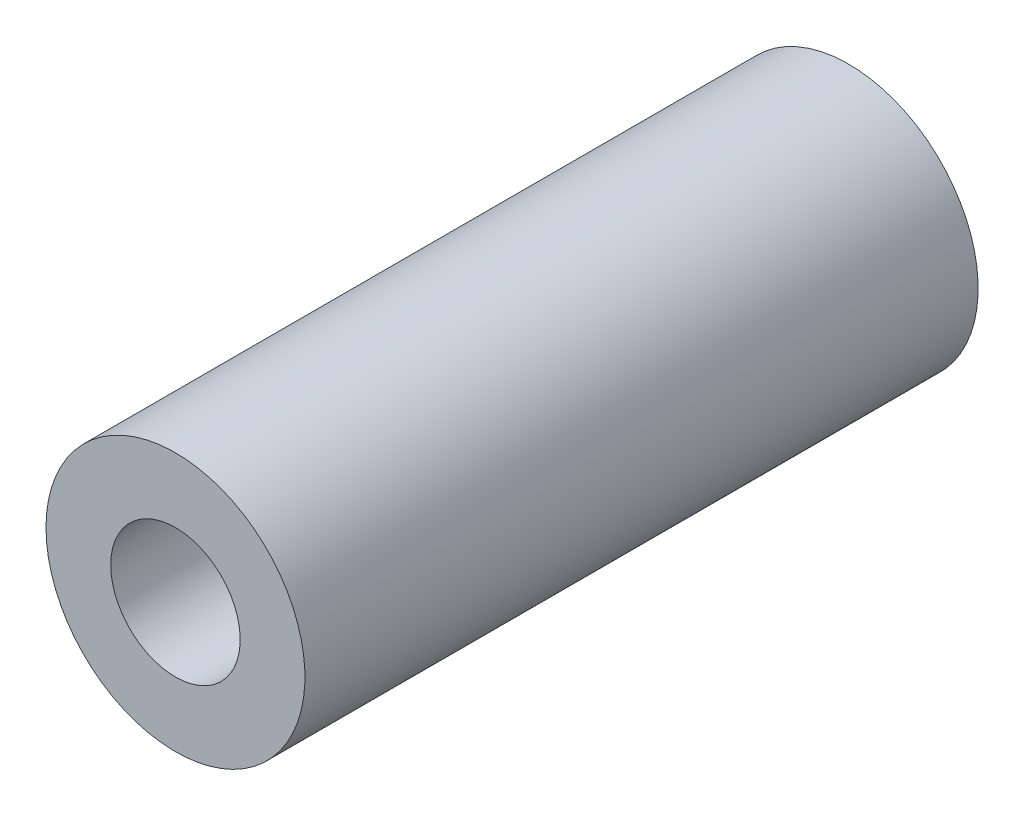
from build123d import *

# Parameters (mm, degrees)
SKETCH1_R           = 5
SKETCH1_R_2         = 2.5
BOSS_EXTRUDE1_DEPTH = 26


with BuildPart() as part:
    # Sketch1 → Boss-Extrude1 (new body)
    with BuildSketch(Plane.XY):
        with Locations(Location((0, 0, 0), (0, 0, 180))):
            Circle(SKETCH1_R)
        with Locations(Location((0, 0, 0), (0, 0, 180))):
            Circle(SKETCH1_R_2, mode=Mode.SUBTRACT)
    extrude(amount=BOSS_EXTRUDE1_DEPTH)


solid = part.part
